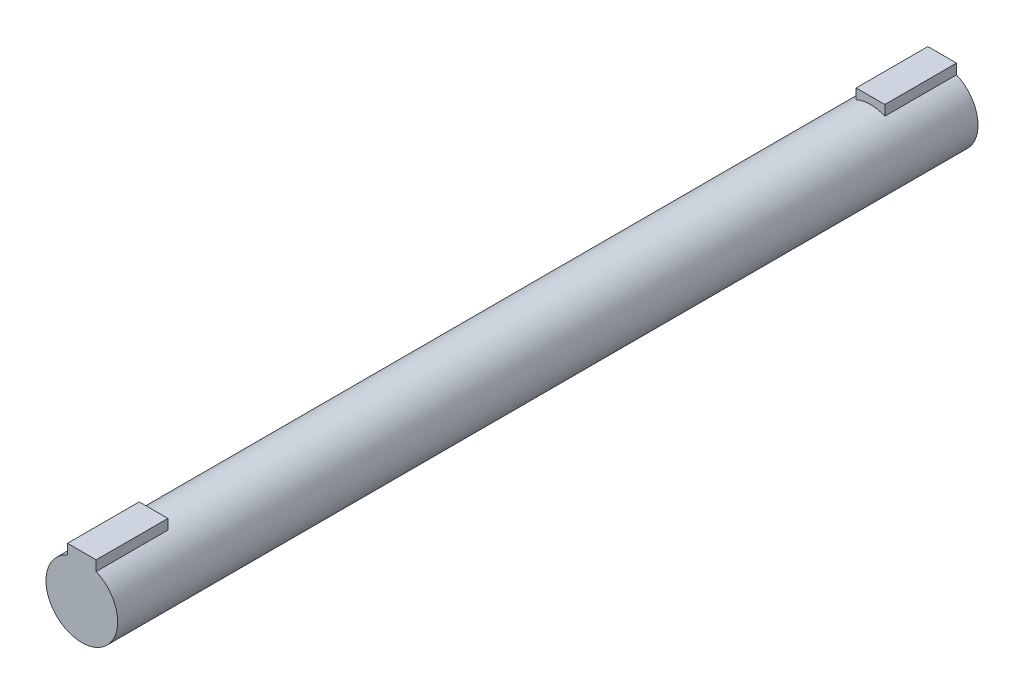
from build123d import *

# Parameters (mm, degrees)
EXTRUDE_1_DEPTH = 5
SKETCH_2_R      = 2.5
EXTRUDE_2_DEPTH = 50
EXTRUDE_3_DEPTH = 5


with BuildPart() as part:
    # 草图1 → 凸台-拉伸1 (new body)
    with BuildSketch(Plane.XY):
        with BuildLine():
            Line((-1, 3), (1, 3))
            Line((1, 3), (1, 2.291287847))
            ThreePointArc((1, 2.291287847), (0, -2.5), (-1, 2.291287847))
            Line((-1, 2.291287847), (-1, 3))
        make_face()
    extrude(amount=EXTRUDE_1_DEPTH)

    # 草图2 → 凸台-拉伸2 (add)
    with BuildSketch(Plane.XY.offset(5)):
        with Locations(Location((0, 0, 0), (0, 0, 113.578178478))):
            Circle(SKETCH_2_R)
    extrude(amount=EXTRUDE_2_DEPTH)

    # 草图3 → 凸台-拉伸3 (add)
    with BuildSketch(Plane.XY.offset(55)):
        with BuildLine():
            Line((-1, 3), (1, 3))
            Line((1, 3), (1, 2.291287847))
            ThreePointArc((1, 2.291287847), (0, -2.5), (-1, 2.291287847))
            Line((-1, 2.291287847), (-1, 3))
        make_face()
    extrude(amount=EXTRUDE_3_DEPTH)


solid = part.part
